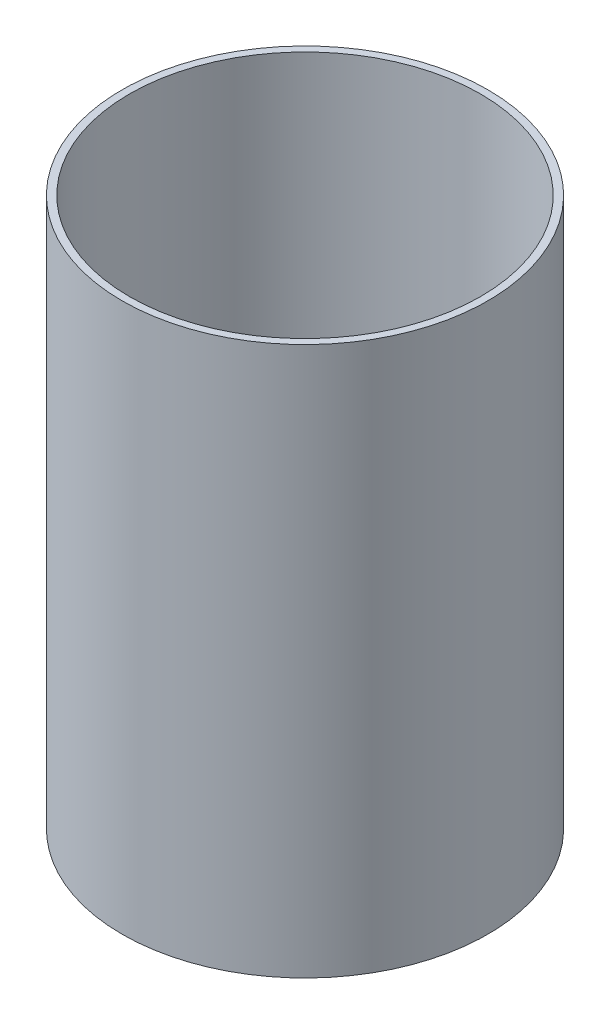
from build123d import *

# Parameters (mm, degrees)
SKETCH1_R           = 50
SKETCH1_R_2         = 48
BOSS_EXTRUDE2_DEPTH = 150


with BuildPart() as part:
    # Sketch1 → Boss-Extrude2 (new body)
    with BuildSketch(Plane(origin=(0, 0, 0), x_dir=(1, 0, 0), z_dir=(0, 1, 0))):
        with Locations(Location((0, 0, 0), (0, 0, 270))):
            Circle(SKETCH1_R)
        with Locations(Location((0, 0, 0), (0, 0, 270))):
            Circle(SKETCH1_R_2, mode=Mode.SUBTRACT)
    extrude(amount=BOSS_EXTRUDE2_DEPTH)


solid = part.part
